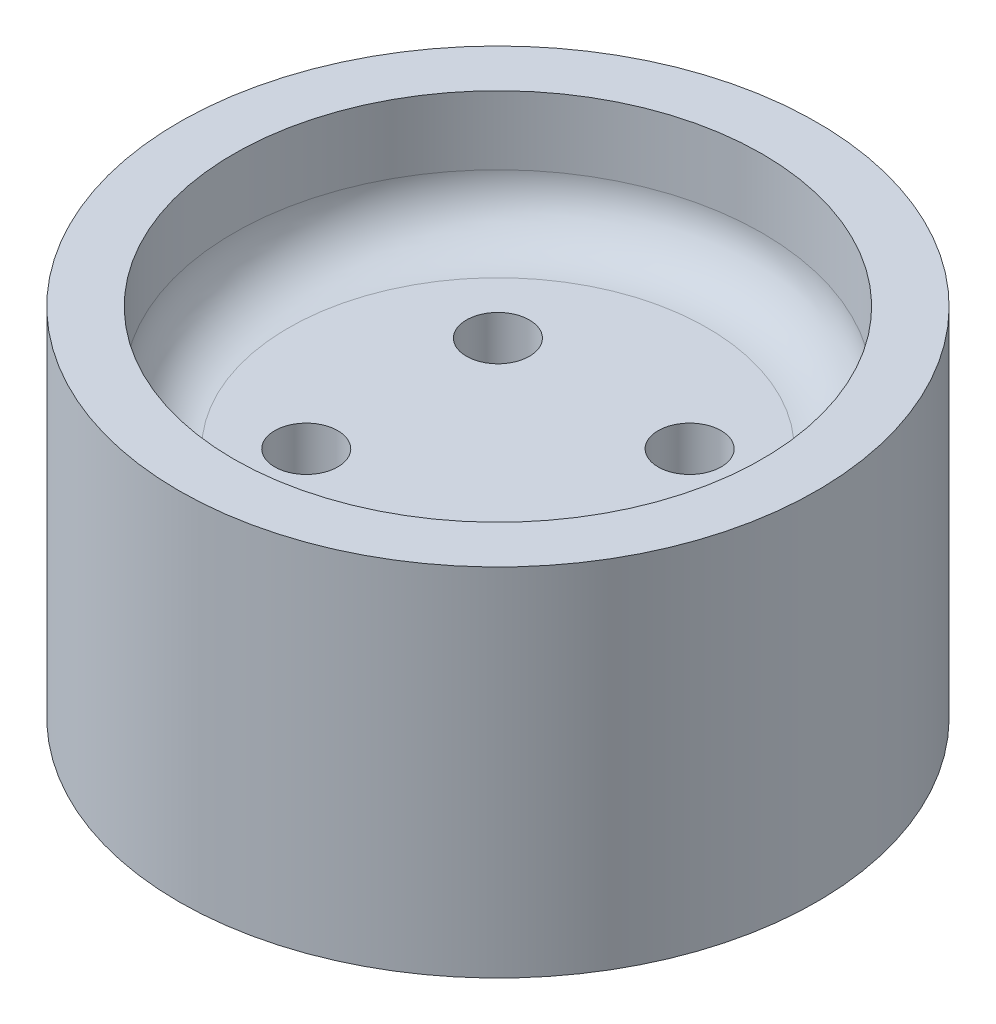
from build123d import *

# Parameters (mm, degrees)
SKETCH1_R           = 11.65
SKETCH1_R_2         = 1.15
BOSS_EXTRUDE1_DEPTH = 8.5
SKETCH3_R           = 11.65
SKETCH3_R_2         = 9.65
BOSS_EXTRUDE3_DEPTH = 4.5
FILLET2_R           = 2


with BuildPart() as part:
    # Sketch1 → Boss-Extrude1 (new body)
    with BuildSketch(Plane(origin=(0, 0, 0), x_dir=(1, 0, 0), z_dir=(0, 1, 0))):
        with Locations(Location((0, 0, 0), (0, 0, 270))):
            Circle(SKETCH1_R)
        with Locations(Location((-3.5, 3.5, 0), (0, 0, 270))):
            Circle(SKETCH1_R_2, mode=Mode.SUBTRACT)
        with Locations(Location((3.5, 3.5, 0), (0, 0, 270))):
            Circle(SKETCH1_R_2, mode=Mode.SUBTRACT)
        with Locations(Location((3.5, -3.5, 0), (0, 0, 270))):
            Circle(SKETCH1_R_2, mode=Mode.SUBTRACT)
        with Locations(Location((-3.5, -3.5, 0), (0, 0, 270))):
            Circle(SKETCH1_R_2, mode=Mode.SUBTRACT)
    extrude(amount=BOSS_EXTRUDE1_DEPTH)

    # Sketch3 → Boss-Extrude3 (add)
    with BuildSketch(Plane(origin=(0, 8.5, 0), x_dir=(1, 0, 0), z_dir=(0, 1, 0))):
        with Locations(Location((0, 0, 0), (0, 0, 270))):
            Circle(SKETCH3_R)
        with Locations(Location((0, 0, 0), (0, 0, 270))):
            Circle(SKETCH3_R_2, mode=Mode.SUBTRACT)
    extrude(amount=BOSS_EXTRUDE3_DEPTH)

    # Fillet2
    fillet2_edges = [part.edges().sort_by_distance(p)[0] for p in [
        (0, 8.5, -9.65),
    ]]
    fillet(fillet2_edges, radius=FILLET2_R)


solid = part.part
